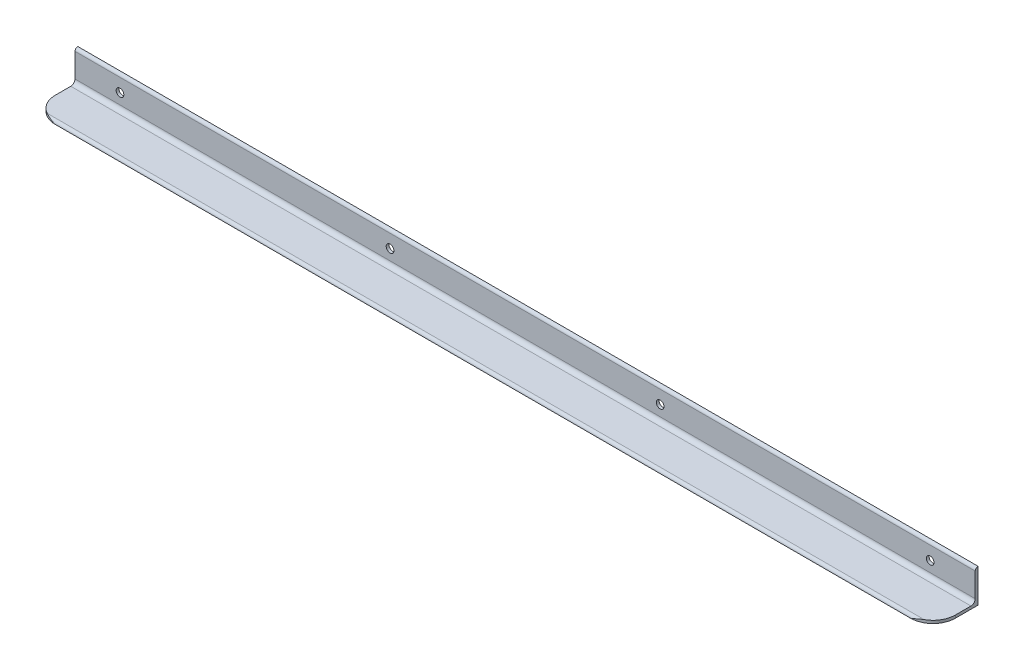
from build123d import *

# Parameters (mm, degrees)
AL_L_ANGLE_ROUNDED_ENDS_L2X1_5X0_125_1_DEPTH = 1016
CUT_EXTRUDE1_DEPTH                           = 512.9533670169578
SKETCH14_R                                   = 4.349749999999978
CUT_EXTRUDE2_DEPTH                           = 512.9533671261084


with BuildPart() as part:
    # Sketch12 → Al l angle (rounded ends) L2X1.5X0.125(1) (new body)
    with BuildSketch(Plane.YZ.offset(-508)):
        with BuildLine():
            Line((0, 0), (-6.94e-15, 50.79999999999999))
            Line((-6.94e-15, 50.79999999999999), (0.00507999999999065, 50.79999999999999))
            ThreePointArc((0.00507999999999065, 50.79999999999999), (2.24655192781885, 49.87155192781885), (3.174999999999991, 47.63007999999999))
            Line((3.174999999999991, 47.63007999999999), (3.1749999999999825, 7.950199999999994))
            ThreePointArc((3.1749999999999825, 7.950199999999994), (4.573623698477981, 4.573623698477992), (7.950199999999982, 3.1749999999999945))
            Line((7.950199999999982, 3.1749999999999945), (34.93008, 3.174999999999994))
            ThreePointArc((34.93008, 3.174999999999994), (37.171551927818854, 2.246551927818857), (38.099999999999994, 0.00507999999999845))
            Line((38.099999999999994, 0.00507999999999845), (38.099999999999994, -1.56e-15))
            Line((38.099999999999994, -1.56e-15), (0, 0))
        make_face()
    extrude(amount=AL_L_ANGLE_ROUNDED_ENDS_L2X1_5X0_125_1_DEPTH)

    # Sketch13 → Cut-Extrude1 (cut, through all)
    with BuildSketch(Plane.XZ):
        with BuildLine():
            Line((-508, 50.79999999999999), (-508, 25.399999999999984))
            ThreePointArc((-508, 25.399999999999984), (-500.5605122421383, 43.3605122421383), (-482.6, 50.79999999999999))
            Line((-482.6, 50.79999999999999), (-508, 50.79999999999999))
        make_face()
        with BuildLine():
            Line((508, 50.79999999999999), (508, 25.399999999999984))
            ThreePointArc((508, 25.399999999999984), (500.5605122421383, 43.3605122421383), (482.6, 50.79999999999999))
            Line((482.6, 50.79999999999999), (508, 50.79999999999999))
        make_face()
    extrude(amount=-CUT_EXTRUDE1_DEPTH, mode=Mode.SUBTRACT)

    # Sketch14 → Cut-Extrude2 (cut, through all)
    with BuildSketch(Plane(origin=(0, 0, 0), x_dir=(-1, 0, 0), z_dir=(0, -4e-17, -1))):
        with Locations(Location((457.20000000000005, 20.000000000006384, 0), (0, 0, 90))):
            Circle(SKETCH14_R)
        with Locations(Location((152.40000000000003, 20.000000000004256, 0), (0, 0, 90))):
            Circle(SKETCH14_R)
        with Locations(Location((-152.39999999999998, 20.000000000002128, 0), (0, 0, 90))):
            Circle(SKETCH14_R)
        with Locations(Location((-457.20000000000005, 20, 0), (0, 0, 90))):
            Circle(SKETCH14_R)
    extrude(amount=-CUT_EXTRUDE2_DEPTH, mode=Mode.SUBTRACT)


solid = part.part
